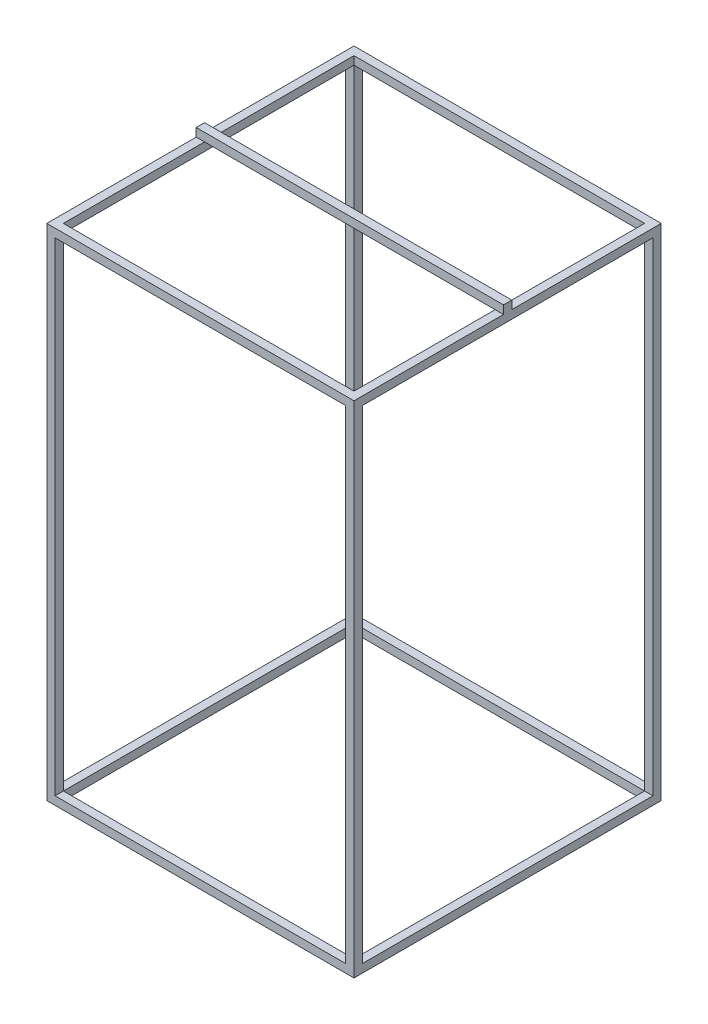
from build123d import *

# Parameters (mm, degrees)
SKETCH2_W           = 1524
SKETCH2_H           = 1524
SKETCH2_W_2         = 1441.45
SKETCH2_H_2         = 1441.45
BOSS_EXTRUDE1_DEPTH = 41.275
SKETCH2_4_W         = 41.275
SKETCH2_4_H         = 41.275
BOSS_EXTRUDE2_DEPTH = 2438.4
BOSS_EXTRUDE3_START = 2438.4
SKETCH2_5_W         = 1524
SKETCH2_5_H         = 1524
SKETCH2_5_W_2       = 1441.45
SKETCH2_5_H_2       = 1441.45
BOSS_EXTRUDE3_DEPTH = 41.275
BOSS_EXTRUDE5_START = 2479.675
SKETCH2_6_W         = 1441.45
SKETCH2_6_H         = 41.275
SKETCH2_6_W_2       = 41.275
BOSS_EXTRUDE5_DEPTH = 41.275


with BuildPart() as part:
    # Sketch2 → Boss-Extrude1 (new body)
    with BuildSketch(Plane(origin=(0, 0, 0), x_dir=(1, 0, 0), z_dir=(0, 1, 0))):
        Rectangle(SKETCH2_W, SKETCH2_H)
        Rectangle(SKETCH2_W_2, SKETCH2_H_2, mode=Mode.SUBTRACT)
    extrude(amount=BOSS_EXTRUDE1_DEPTH)

    # Sketch2<4> → Boss-Extrude2 (add)
    with BuildSketch(Plane(origin=(0, 0, 0), x_dir=(1, 0, 0), z_dir=(0, 1, 0))):
        with Locations((-741.3625, 741.3625)):
            Rectangle(SKETCH2_4_W, SKETCH2_4_H)
        with Locations((741.3625, 741.3625)):
            Rectangle(SKETCH2_4_W, SKETCH2_4_H)
        with Locations((741.3625, -741.3625)):
            Rectangle(SKETCH2_4_W, SKETCH2_4_H)
        with Locations((-741.3625, -741.3625)):
            Rectangle(SKETCH2_4_W, SKETCH2_4_H)
    extrude(amount=BOSS_EXTRUDE2_DEPTH)

    # Sketch2<5> → Boss-Extrude3 (add)
    with BuildSketch(Plane(origin=(0, 0, 0), x_dir=(1, 0, 0), z_dir=(0, 1, 0)).offset(BOSS_EXTRUDE3_START)):
        Rectangle(SKETCH2_5_W, SKETCH2_5_H)
        Rectangle(SKETCH2_5_W_2, SKETCH2_5_H_2, mode=Mode.SUBTRACT)
    extrude(amount=BOSS_EXTRUDE3_DEPTH)

    # Sketch2<6> → Boss-Extrude5 (add)
    with BuildSketch(Plane(origin=(0, 0, 0), x_dir=(1, 0, 0), z_dir=(0, 1, 0)).offset(BOSS_EXTRUDE5_START)):
        Rectangle(SKETCH2_6_W, SKETCH2_6_H)
        with Locations((741.3625, 0)):
            Rectangle(SKETCH2_6_W_2, SKETCH2_6_H)
        with Locations((-741.3625, 0)):
            Rectangle(SKETCH2_6_W_2, SKETCH2_6_H)
    extrude(amount=BOSS_EXTRUDE5_DEPTH)


solid = part.part
